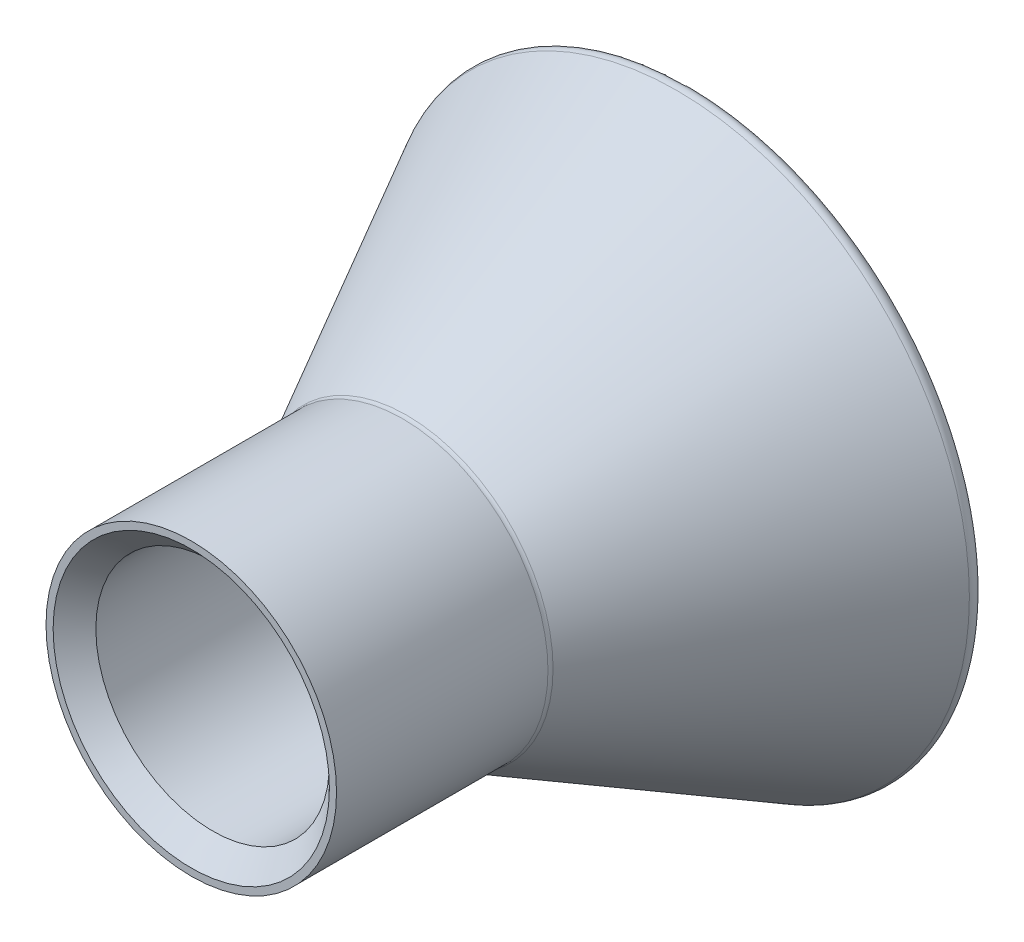
from build123d import *

# Parameters (mm, degrees)
SKETCH3_R          = 8.2
CUT_EXTRUDE1_DEPTH = 40
CHAMFER1_SIZE      = 1.5
FILLET2_R          = 0.6
FILLET3_R          = 0.6
FILLET4_R          = 0.6


with BuildPart() as part:
    # Sketch2 → Revolve1 (revolve)
    with BuildSketch(Plane(origin=(0, 0, 0), x_dir=(0, 0, -1), z_dir=(1, 0, 0)), mode=Mode.PRIVATE) as revolve1_sk:
        Polygon((-15, 10.2), (-15, 0), (0, 0), (0, 8.2), (20, 19), (20, 21), (0, 10.2), align=None)
    revolve(revolve1_sk.sketch.rotate(Axis((0, 0, 15), (0, 0, -1)), 90), axis=Axis((0, 0, 15), (0, 0, -1)))

    # Sketch3 → Cut-Extrude1 (cut)
    with BuildSketch(Plane.XY.offset(15)):
        Circle(SKETCH3_R)
    extrude(amount=-CUT_EXTRUDE1_DEPTH, mode=Mode.SUBTRACT)

    # Chamfer1
    chamfer1_edges = [part.edges().sort_by_distance(p)[0] for p in [
        (-8.2, 0, 15),
    ]]
    chamfer(chamfer1_edges, length=CHAMFER1_SIZE)

    # Fillet2
    fillet2_edges = [part.edges().sort_by_distance(p)[0] for p in [
        (-21, 0, -20),
        (-19, 0, -20),
    ]]
    fillet(fillet2_edges, radius=FILLET2_R)

    # Fillet3
    fillet3_edges = [part.edges().sort_by_distance(p)[0] for p in [
        (-10.2, 0, 0),
    ]]
    fillet(fillet3_edges, radius=FILLET3_R)

    # Fillet4
    fillet4_edges = [part.edges().sort_by_distance(p)[0] for p in [
        (-8.2, 0, 0),
    ]]
    fillet(fillet4_edges, radius=FILLET4_R)


solid = part.part
